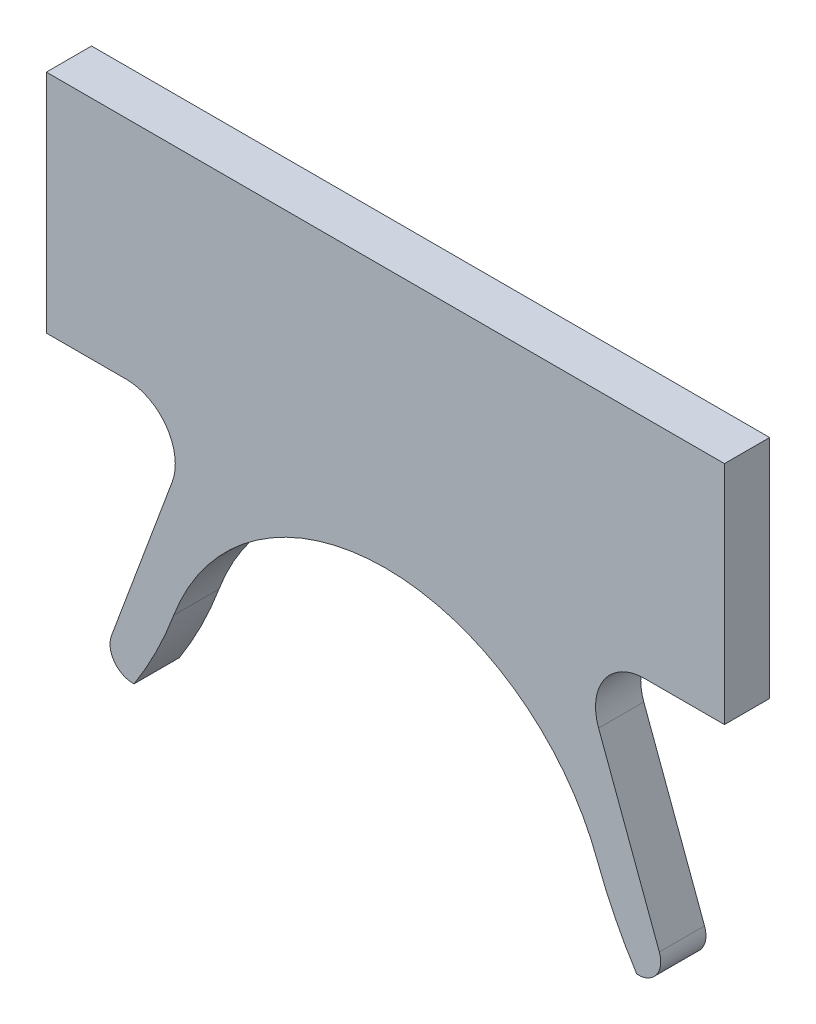
from build123d import *

# Parameters (mm, degrees)
EXTRUDE_1_DEPTH = 4


with BuildPart() as part:
    # 草图1 → 凸台-拉伸1 (new body)
    with BuildSketch(Plane.XY):
        with BuildLine():
            Line((-22.239358256, 0), (-22.36290973, 0))
            ThreePointArc((-22.36290973, 0), (-24.004989759, 0.858258708), (-24.237740304, 2.696426821))
            Line((-24.237740304, 2.696426821), (-18.862727252, 17.166344555))
            ThreePointArc((-18.862727252, 17.166344555), (-19.366277535, 21.143177652), (-22.918878713, 23))
            Line((-22.918878713, 23), (-30, 23))
            Line((-30, 23), (-30, 43))
            Line((-30, 43), (30, 43))
            Line((30, 43), (30, 23))
            Line((30, 23), (22.918878713, 23))
            ThreePointArc((22.918878713, 23), (19.366277535, 21.143177652), (18.862727252, 17.166344555))
            Line((18.862727252, 17.166344555), (24.237740304, 2.696426821))
            ThreePointArc((24.237740304, 2.696426821), (24.004989759, 0.858258708), (22.36290973, 0))
            Line((22.36290973, 0), (22.239358256, 0))
            ThreePointArc((22.239358256, 0), (20.299537687, 3.412102539), (18.731211271, 7.010115856))
            ThreePointArc((18.731211271, 7.010115856), (0, 20), (-18.731211271, 7.010115856))
            ThreePointArc((-18.731211271, 7.010115856), (-20.299537687, 3.412102539), (-22.239358256, 0))
        make_face()
    extrude(amount=EXTRUDE_1_DEPTH)


solid = part.part
